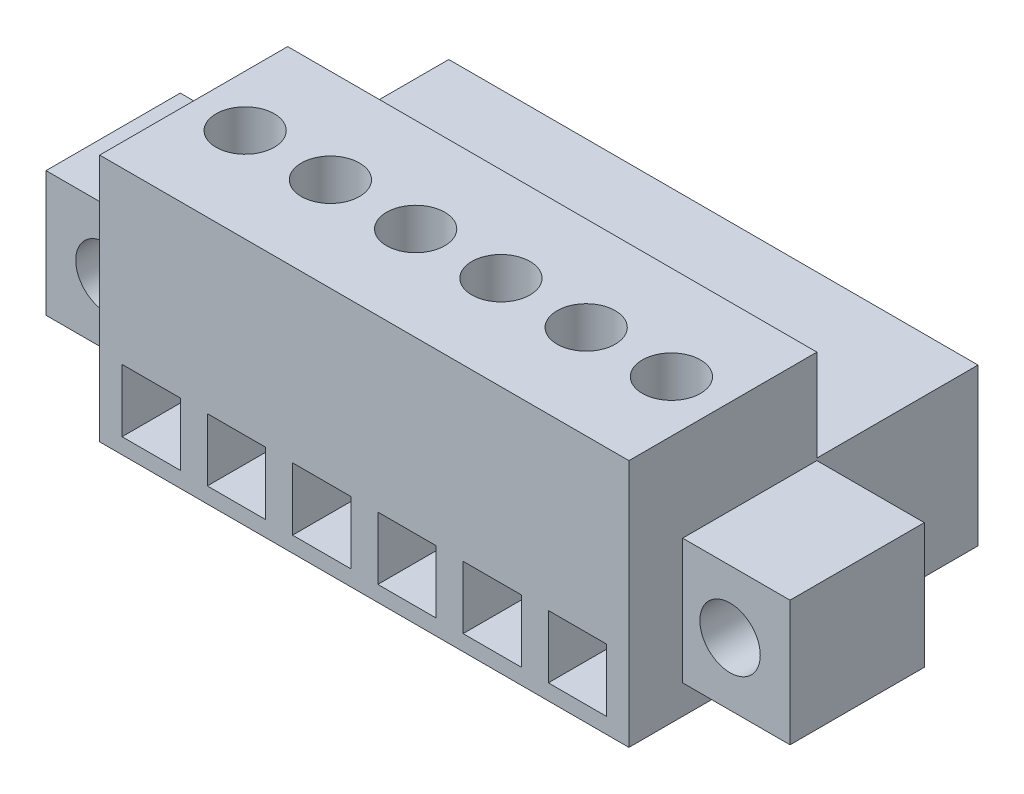
from build123d import *

# Parameters (mm, degrees)
SK_BODY_W                     = 23.65
SK_BODY_H                     = 11.1
BODY_DEPTH                    = 8.4
SK_FLANGE_EARS_W              = 4.8
SK_FLANGE_EARS_H              = 5.6
FLANGE_EARS_DEPTH             = 6
SK_NOSE_W                     = 23.65
SK_NOSE_H                     = 7
NOSE_DEPTH                    = 7.2
FLANGE_SCREW_HOLES_DEPTH      = 22.338946202
FLANGE_SCREW_HOLES_DEPTH_BACK = 22.338946202
SK_FLANGE_SCREW_HOLES_R       = 1.35
SK_WIRE_ENTRIES_W             = 2.6
SK_WIRE_ENTRIES_H             = 2.8
WIRE_ENTRIES_DEPTH            = 6
SK_CONTACT_OPENINGS_W         = 1.6
SK_CONTACT_OPENINGS_H         = 1.6
CONTACT_OPENINGS_DEPTH        = 6.2
SK_CLAMP_SCREW_HOLES_R        = 1.3
CLAMP_SCREW_HOLES_DEPTH       = 3


with BuildPart() as part:
    # SK Body → Body (new body)
    with BuildSketch(Plane.XY.offset(3)):
        with Locations((0, 1.45)):
            Rectangle(SK_BODY_W, SK_BODY_H)
    extrude(amount=BODY_DEPTH)

    # SK Flange ears → Flange ears (add)
    with BuildSketch(Plane.XY.offset(3)):
        with Locations((14.225, 0)):
            Rectangle(SK_FLANGE_EARS_W, SK_FLANGE_EARS_H)
        with Locations((-14.225, 0)):
            Rectangle(SK_FLANGE_EARS_W, SK_FLANGE_EARS_H)
    extrude(amount=FLANGE_EARS_DEPTH)

    # SK Nose → Nose (add)
    with BuildSketch(Plane.XY.offset(3)):
        with Locations((0, -0.6)):
            Rectangle(SK_NOSE_W, SK_NOSE_H)
    extrude(amount=-NOSE_DEPTH)

    # SK Flange screw holes → Flange screw holes (cut, two sides: drawn at the far end of the back side and taken through both)
    with BuildSketch(Plane.XY.offset(-FLANGE_SCREW_HOLES_DEPTH_BACK)):
        with Locations((-13.945, 0)):
            Circle(SK_FLANGE_SCREW_HOLES_R)
        with Locations((13.945, 0)):
            Circle(SK_FLANGE_SCREW_HOLES_R)
    extrude(amount=FLANGE_SCREW_HOLES_DEPTH + FLANGE_SCREW_HOLES_DEPTH_BACK, mode=Mode.SUBTRACT)

    # SK Wire entries → Wire entries (cut)
    with BuildSketch(Plane.XY.offset(11.4)):
        with Locations((-9.525, -2)):
            Rectangle(SK_WIRE_ENTRIES_W, SK_WIRE_ENTRIES_H)
        with Locations((-5.715, -2)):
            Rectangle(SK_WIRE_ENTRIES_W, SK_WIRE_ENTRIES_H)
        with Locations((-1.905, -2)):
            Rectangle(SK_WIRE_ENTRIES_W, SK_WIRE_ENTRIES_H)
        with Locations((1.905, -2)):
            Rectangle(SK_WIRE_ENTRIES_W, SK_WIRE_ENTRIES_H)
        with Locations((5.715, -2)):
            Rectangle(SK_WIRE_ENTRIES_W, SK_WIRE_ENTRIES_H)
        with Locations((9.525, -2)):
            Rectangle(SK_WIRE_ENTRIES_W, SK_WIRE_ENTRIES_H)
    extrude(amount=-WIRE_ENTRIES_DEPTH, mode=Mode.SUBTRACT)

    # SK Contact openings → Contact openings (cut)
    with BuildSketch(Plane.XY.offset(-4.2)):
        with Locations((-9.525, -0.6)):
            Rectangle(SK_CONTACT_OPENINGS_W, SK_CONTACT_OPENINGS_H)
        with Locations((-5.715, -0.6)):
            Rectangle(SK_CONTACT_OPENINGS_W, SK_CONTACT_OPENINGS_H)
        with Locations((-1.905, -0.6)):
            Rectangle(SK_CONTACT_OPENINGS_W, SK_CONTACT_OPENINGS_H)
        with Locations((1.905, -0.6)):
            Rectangle(SK_CONTACT_OPENINGS_W, SK_CONTACT_OPENINGS_H)
        with Locations((5.715, -0.6)):
            Rectangle(SK_CONTACT_OPENINGS_W, SK_CONTACT_OPENINGS_H)
        with Locations((9.525, -0.6)):
            Rectangle(SK_CONTACT_OPENINGS_W, SK_CONTACT_OPENINGS_H)
    extrude(amount=CONTACT_OPENINGS_DEPTH, mode=Mode.SUBTRACT)

    # SK Clamp screw holes → Clamp screw holes (cut)
    with BuildSketch(Plane(origin=(0, 7, 0), x_dir=(1, 0, 0), z_dir=(0, 1, 0))):
        with Locations(Location((-9.525, -7.2, 0), (0, 0, 270))):
            Circle(SK_CLAMP_SCREW_HOLES_R)
        with Locations(Location((-5.715, -7.2, 0), (0, 0, 270))):
            Circle(SK_CLAMP_SCREW_HOLES_R)
        with Locations(Location((-1.905, -7.2, 0), (0, 0, 270))):
            Circle(SK_CLAMP_SCREW_HOLES_R)
        with Locations(Location((1.905, -7.2, 0), (0, 0, 270))):
            Circle(SK_CLAMP_SCREW_HOLES_R)
        with Locations(Location((5.715, -7.2, 0), (0, 0, 270))):
            Circle(SK_CLAMP_SCREW_HOLES_R)
        with Locations(Location((9.525, -7.2, 0), (0, 0, 270))):
            Circle(SK_CLAMP_SCREW_HOLES_R)
    extrude(amount=-CLAMP_SCREW_HOLES_DEPTH, mode=Mode.SUBTRACT)


solid = part.part
